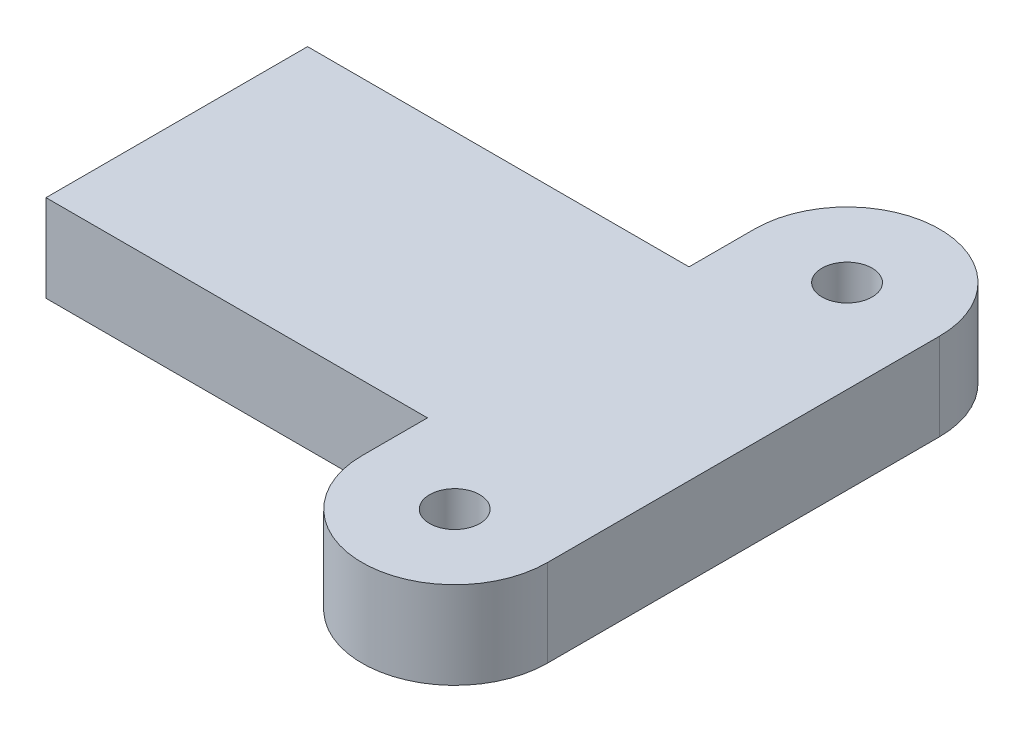
from build123d import *

# Parameters (mm, degrees)
ESBO_O1_R                = 1.15
RESSALTO_EXTRUS_O1_DEPTH = 4


with BuildPart() as part:
    # Esboço1 → Ressalto-extrusão1 (new body)
    with BuildSketch(Plane(origin=(0, 0, 0), x_dir=(1, 0, 0), z_dir=(0, 1, 0))):
        with BuildLine():
            Line((-8.5, 9), (-8.5, 6))
            Line((-8.5, 6), (-26, 6))
            Line((-26, 6), (-26, -6))
            Line((-26, -6), (-8.5, -6))
            Line((-8.5, -6), (-8.5, -9))
            ThreePointArc((-8.5, -9), (-4.25, -13.25), (0, -9))
            Line((0, -9), (0, 9))
            ThreePointArc((0, 9), (-4.25, 13.25), (-8.5, 9))
        make_face()
        with Locations(Location((-4.25, 9, 0), (0, 0, 270))):
            Circle(ESBO_O1_R, mode=Mode.SUBTRACT)
        with Locations(Location((-4.25, -9, 0), (0, 0, 270))):
            Circle(ESBO_O1_R, mode=Mode.SUBTRACT)
    extrude(amount=RESSALTO_EXTRUS_O1_DEPTH)


solid = part.part
